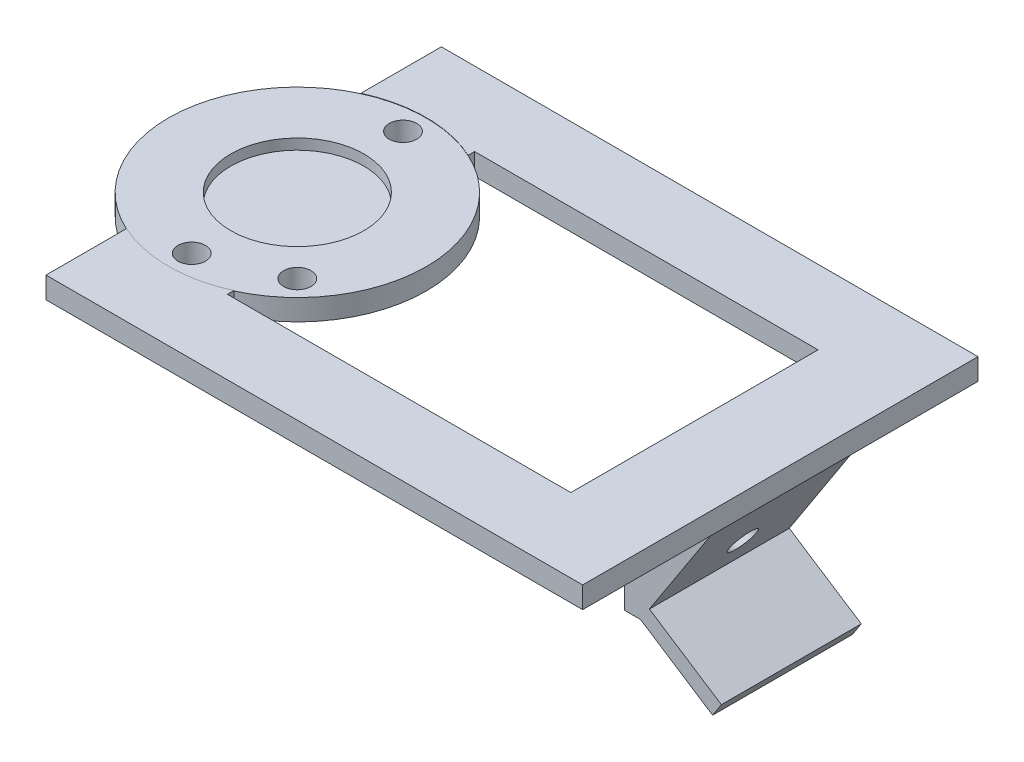
from build123d import *

# Parameters (mm, degrees)
SKETCH1_R           = 30.5
BOSS_EXTRUDE1_DEPTH = 5
SKETCH2_R           = 15.75
CUT_EXTRUDE1_DEPTH  = 2.5
SKETCH3_R           = 15.75
BOSS_EXTRUDE2_DEPTH = 2.5
SKETCH4_R           = 3.25
CUT_EXTRUDE2_DEPTH  = 5.08
SKETCH5_R           = 3.25
CUT_EXTRUDE3_DEPTH  = 5.08
SKETCH6_R           = 3.25
CUT_EXTRUDE4_DEPTH  = 5.08
BOSS_EXTRUDE3_DEPTH = 5.08
BOSS_EXTRUDE4_DEPTH = 5.08
SKETCH9_W           = 17.526
SKETCH9_H           = 5.08
BOSS_EXTRUDE5_DEPTH = 101.6
SKETCH10_W          = 17.526
SKETCH10_H          = 5.08
BOSS_EXTRUDE6_DEPTH = 101.6
SKETCH11_W          = 20.32
SKETCH11_H          = 5.08
BOSS_EXTRUDE7_DEPTH = 63.5
SKETCH12_W          = 20.32
SKETCH12_H          = 33.10825604
BOSS_EXTRUDE8_DEPTH = 25.4
CUT_EXTRUDE5_DEPTH  = 33.274
CUT_EXTRUDE6_DEPTH  = 33.274
SKETCH16_W          = 33.10825604
SKETCH16_H          = 3.81
BOSS_EXTRUDE9_DEPTH = 20.32
CUT_EXTRUDE7_DEPTH  = 7.62
SKETCH20_R          = 4.826
CUT_EXTRUDE9_DEPTH  = 2.54


with BuildPart() as part:
    # Sketch1 → Boss-Extrude1 (new body)
    with BuildSketch(Plane(origin=(0, 0, 0), x_dir=(1, 0, 0), z_dir=(0, 1, 0))):
        with Locations(Location((0, 0, 0), (0, 0, 270))):
            Circle(SKETCH1_R)
    extrude(amount=BOSS_EXTRUDE1_DEPTH)

    # Sketch2 → Cut-Extrude1 (cut)
    with BuildSketch(Plane(origin=(0, 5, 0), x_dir=(1, 0, 0), z_dir=(0, 1, 0))):
        with Locations(Location((0, 0, 0), (0, 0, 270))):
            Circle(SKETCH2_R)
    extrude(amount=-CUT_EXTRUDE1_DEPTH, mode=Mode.SUBTRACT)

    # Sketch3 → Boss-Extrude2 (add)
    with BuildSketch(Plane.XZ):
        with Locations(Location((0, 0, 0), (0, 0, 90))):
            Circle(SKETCH3_R)
    extrude(amount=BOSS_EXTRUDE2_DEPTH)

    # Sketch4 → Cut-Extrude2 (cut)
    with BuildSketch(Plane(origin=(0, 0, 0), x_dir=(-1, 0, 0), z_dir=(0, -1, 0))):
        with Locations(Location((0, 25, 0), (0, 0, 90))):
            Circle(SKETCH4_R)
    extrude(amount=-CUT_EXTRUDE2_DEPTH, mode=Mode.SUBTRACT)

    # Sketch5 → Cut-Extrude3 (cut)
    with BuildSketch(Plane.XZ):
        with Locations(Location((0, 25, 0), (0, 0, 270))):
            Circle(SKETCH5_R)
    extrude(amount=-CUT_EXTRUDE3_DEPTH, mode=Mode.SUBTRACT)

    # Sketch6 → Cut-Extrude4 (cut)
    with BuildSketch(Plane.XZ):
        with Locations(Location((17.674476483, 17.680862, 0), (0, 0, 270))):
            Circle(SKETCH6_R)
    extrude(amount=-CUT_EXTRUDE4_DEPTH, mode=Mode.SUBTRACT)

    # Sketch7 → Boss-Extrude3 (add)
    with BuildSketch(Plane(origin=(0, 0, 0), x_dir=(-1, 0, 0), z_dir=(0, -1, 0))):
        with BuildLine():
            ThreePointArc((12.7, -27.73012802), (6.499272859, -29.79948745), (0, -30.5))
            ThreePointArc((0, -30.5), (-6.499272859, -29.79948745), (-12.7, -27.73012802))
            Line((-12.7, -27.73012802), (-12.7, -46.78012802))
            Line((-12.7, -46.78012802), (12.7, -46.78012802))
            Line((12.7, -46.78012802), (12.7, -27.73012802))
        make_face()
    extrude(amount=-BOSS_EXTRUDE3_DEPTH)

    # Sketch8 → Boss-Extrude4 (add)
    with BuildSketch(Plane.XZ):
        with BuildLine():
            ThreePointArc((0, -30.5), (-6.499272859, -29.79948745), (-12.7, -27.73012802))
            Line((-12.7, -27.73012802), (-12.7, -46.78012802))
            Line((-12.7, -46.78012802), (12.7, -46.78012802))
            Line((12.7, -46.78012802), (12.7, -27.73012802))
            ThreePointArc((12.7, -27.73012802), (6.499272859, -29.79948745), (0, -30.5))
        make_face()
    extrude(amount=-BOSS_EXTRUDE4_DEPTH)

    # Sketch9 → Boss-Extrude5 (add)
    with BuildSketch(Plane(origin=(12.7, 0, 0), x_dir=(0, 0, -1), z_dir=(1, 0, 0))):
        with Locations((38.01712802, 2.54)):
            Rectangle(SKETCH9_W, SKETCH9_H)
    extrude(amount=BOSS_EXTRUDE5_DEPTH)

    # Sketch10 → Boss-Extrude6 (add)
    with BuildSketch(Plane(origin=(12.7, 0, 0), x_dir=(0, 0, -1), z_dir=(1, 0, 0))):
        with Locations((-38.01712802, 2.54)):
            Rectangle(SKETCH10_W, SKETCH10_H)
    extrude(amount=BOSS_EXTRUDE6_DEPTH)

    # Sketch11 → Boss-Extrude7 (add)
    with BuildSketch(Plane(origin=(0, 0, 29.25412802), x_dir=(-1, 0, 0), z_dir=(0, 0, -1))):
        with Locations((-104.14, 2.54)):
            Rectangle(SKETCH11_W, SKETCH11_H)
    extrude(amount=BOSS_EXTRUDE7_DEPTH)

    # Sketch12 → Boss-Extrude8 (add)
    with BuildSketch(Plane.XZ):
        with Locations((104.14, 0)):
            Rectangle(SKETCH12_W, SKETCH12_H)
    extrude(amount=BOSS_EXTRUDE8_DEPTH)

    # Sketch13 → Cut-Extrude5 (cut)
    with BuildSketch(Plane.XY.offset(16.55412802)):
        Polygon((114.3, -25.4), (97.79, -25.4), (114.3, 0), align=None)
    extrude(amount=-CUT_EXTRUDE5_DEPTH, mode=Mode.SUBTRACT)

    # Sketch14 → Cut-Extrude6 (cut)
    with BuildSketch(Plane.XY.offset(16.55412802)):
        Polygon((93.98, 0), (93.98, -17.78), (106.68, 0), align=None)
    extrude(amount=-CUT_EXTRUDE6_DEPTH, mode=Mode.SUBTRACT)

    # Sketch16 → Boss-Extrude9 (add)
    with BuildSketch(Plane(origin=(80.351493849, -52.228471002, 0), x_dir=(0, 0, -1), z_dir=(0.8384436163006371, -0.5449883505954142, 0))):
        with Locations((0, 33.902942951)):
            Rectangle(SKETCH16_W, SKETCH16_H)
    extrude(amount=BOSS_EXTRUDE9_DEPTH)

    # Sketch18 → Cut-Extrude7 (cut)
    with BuildSketch(Plane(origin=(80.351493849, -52.228471002, 0), x_dir=(0, 0, -1), z_dir=(0.8384436163006371, -0.5449883505954142, 0))):
        with BuildLine():
            ThreePointArc((0, 49.269942951), (-3.302, 45.967942951), (0, 42.665942951))
            Line((0, 42.665942951), (0, 49.269942951))
        make_face()
        with BuildLine():
            Line((0, 49.269942951), (0, 42.665942951))
            ThreePointArc((0, 42.665942951), (2.334866591, 43.633076359), (3.302, 45.967942951))
            ThreePointArc((3.302, 45.967942951), (2.334866591, 48.302809542), (0, 49.269942951))
        make_face()
    extrude(amount=-CUT_EXTRUDE7_DEPTH, mode=Mode.SUBTRACT)

    # Sketch20 → Cut-Extrude9 (cut)
    with BuildSketch(Plane(origin=(70.639459459, -50.456756757, 0), x_dir=(0, 0, 1), z_dir=(-0.8137334712067354, 0.5812381937190958, 0))):
        with Locations(Location((0, 49.823352123, 0), (0, 0, 270))):
            Circle(SKETCH20_R)
    extrude(amount=-CUT_EXTRUDE9_DEPTH, mode=Mode.SUBTRACT)


solid = part.part
